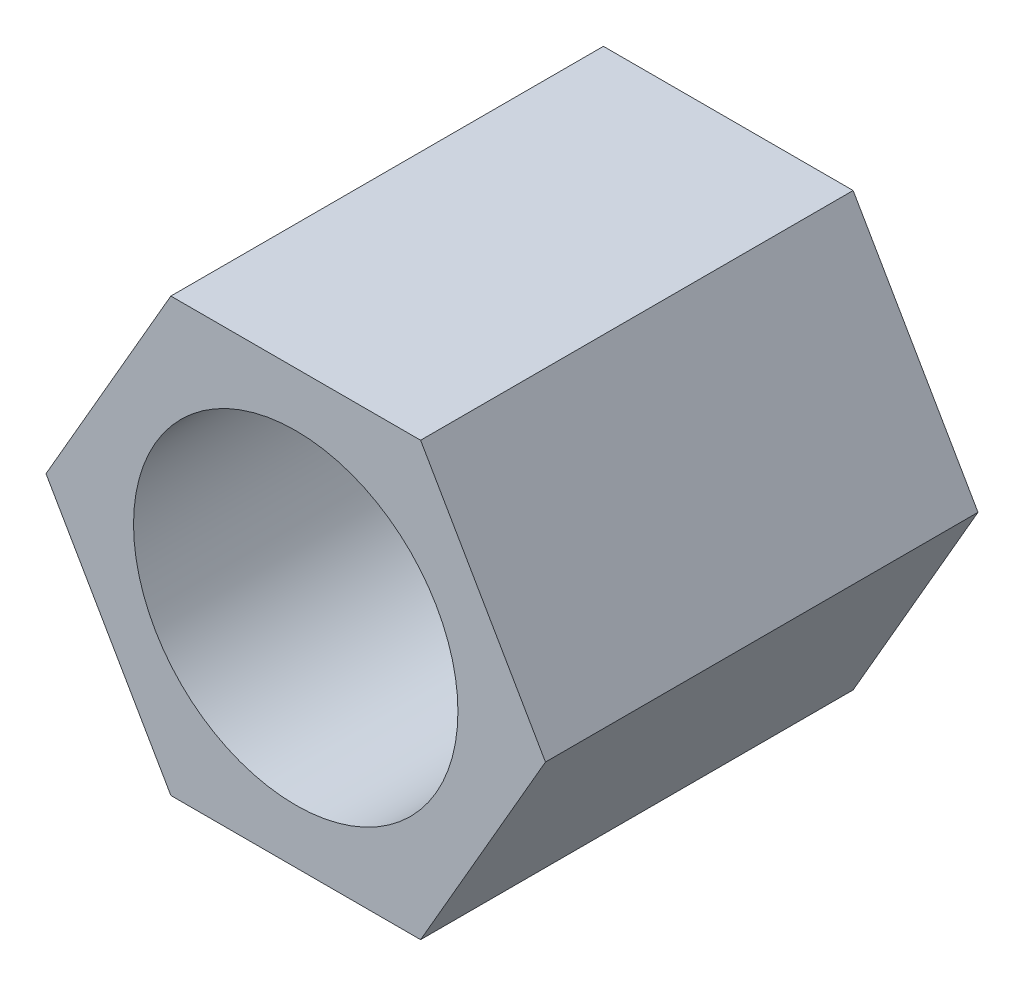
from build123d import *

# Parameters (mm, degrees)
BOSS_EXTRUDE1_DEPTH = 8
SKETCH2_R           = 1.5
CUT_EXTRUDE1_DEPTH  = 11.066445914
SKETCH3_R           = 3
CUT_EXTRUDE2_DEPTH  = 6


with BuildPart() as part:
    # Sketch1 → Boss-Extrude1 (new body)
    with BuildSketch(Plane.XY):
        Polygon((-2.309401077, 4), (-4.618802154, 0), (-2.309401077, -4), (2.309401077, -4), (4.618802154, 0), (2.309401077, 4), align=None)
    extrude(amount=BOSS_EXTRUDE1_DEPTH)

    # Sketch2 → Cut-Extrude1 (cut, through all)
    with BuildSketch(Plane.XY.offset(8)):
        Circle(SKETCH2_R)
    extrude(amount=-CUT_EXTRUDE1_DEPTH, mode=Mode.SUBTRACT)

    # Sketch3 → Cut-Extrude2 (cut)
    with BuildSketch(Plane.XY.offset(8)):
        Circle(SKETCH3_R)
    extrude(amount=-CUT_EXTRUDE2_DEPTH, mode=Mode.SUBTRACT)


solid = part.part
